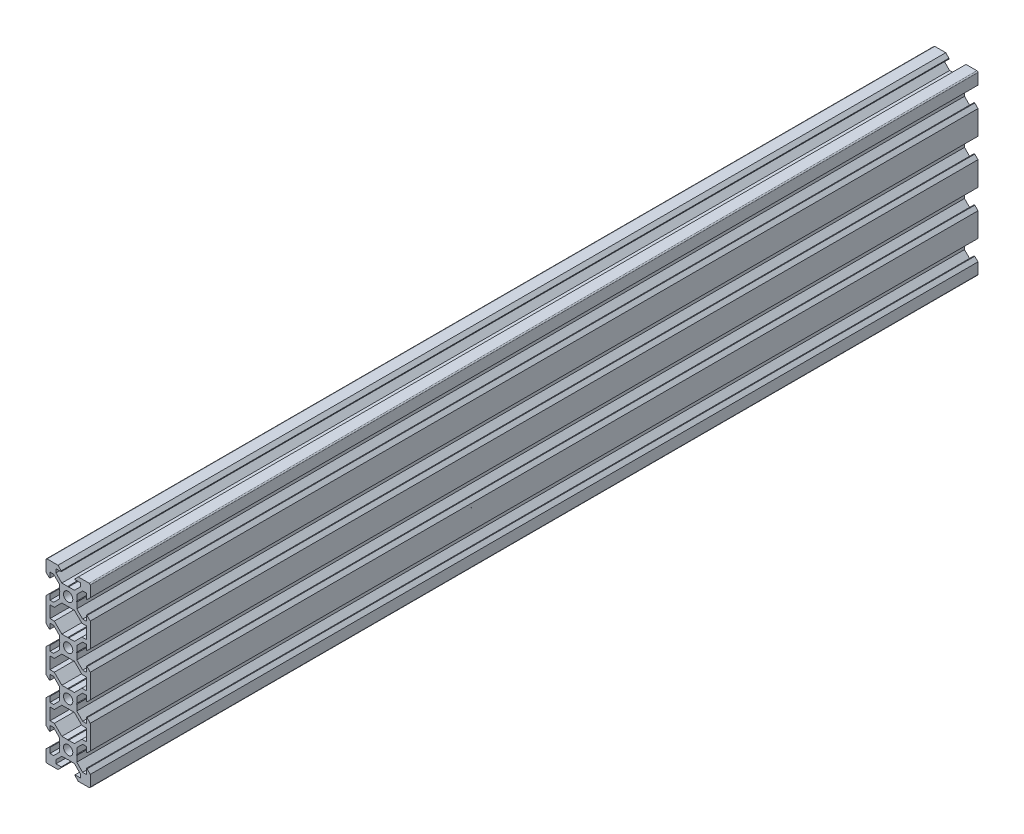
from build123d import *

# Parameters (mm, degrees)
BOSS_EXTRU_1_DEPTH = 401.2


with BuildPart() as part:
    # Esquisse1 → Boss.-Extru.1 (new body)
    with BuildSketch(Plane.XY):
        with BuildLine():
            Line((-9.5, 10), (-4.58, 10))
            Line((-4.58, 10), (-3.125, 8.545))
            Line((-3.125, 8.545), (-3.125, 8.2))
            Line((-3.125, 8.2), (-5.5, 8.2))
            Line((-5.5, 8.2), (-5.5, 6.560660172))
            Line((-5.5, 6.560660172), (-2.839339828, 3.9))
            Line((-2.839339828, 3.9), (-0.21, 3.9))
            Line((-0.21, 3.9), (0, 3.69))
            Line((0, 3.69), (0, 2.1))
            ThreePointArc((0, 2.1), (-2.1, 0), (0, -2.1))
            Line((0, -2.1), (0, -3.69))
            Line((0, -3.69), (-0.21, -3.9))
            Line((-0.21, -3.9), (-2.839339828, -3.9))
            Line((-2.839339828, -3.9), (-6.239339828, -7.3))
            Line((-6.239339828, -7.3), (-8.2, -7.3))
            Line((-8.2, -7.3), (-8.2, -12.7))
            Line((-8.2, -12.7), (-6.239339828, -12.7))
            Line((-6.239339828, -12.7), (-2.839339828, -16.1))
            Line((-2.839339828, -16.1), (-0.21, -16.1))
            Line((-0.21, -16.1), (0, -16.31))
            Line((0, -16.31), (0, -17.9))
            ThreePointArc((0, -17.9), (-2.1, -20), (0, -22.1))
            Line((0, -22.1), (0, -23.69))
            Line((0, -23.69), (-0.21, -23.9))
            Line((-0.21, -23.9), (-2.839339828, -23.9))
            Line((-2.839339828, -23.9), (-6.239339828, -27.3))
            Line((-6.239339828, -27.3), (-8.2, -27.3))
            Line((-8.2, -27.3), (-8.2, -32.7))
            Line((-8.2, -32.7), (-6.239339828, -32.7))
            Line((-6.239339828, -32.7), (-2.839339828, -36.1))
            Line((-2.839339828, -36.1), (-0.21, -36.1))
            Line((-0.21, -36.1), (0, -36.31))
            Line((0, -36.31), (0, -37.9))
            ThreePointArc((0, -37.9), (-2.1, -40), (0, -42.1))
            Line((0, -42.1), (0, -43.69))
            Line((0, -43.69), (-0.21, -43.9))
            Line((-0.21, -43.9), (-2.839339828, -43.9))
            Line((-2.839339828, -43.9), (-6.239339828, -47.3))
            Line((-6.239339828, -47.3), (-8.2, -47.3))
            Line((-8.2, -47.3), (-8.2, -52.7))
            Line((-8.2, -52.7), (-6.239339828, -52.7))
            Line((-6.239339828, -52.7), (-2.839339828, -56.1))
            Line((-2.839339828, -56.1), (-0.21, -56.1))
            Line((-0.21, -56.1), (0, -56.31))
            Line((0, -56.31), (0, -57.9))
            ThreePointArc((0, -57.9), (-2.1, -60), (0, -62.1))
            Line((0, -62.1), (0, -63.69))
            Line((0, -63.69), (-0.21, -63.9))
            Line((-0.21, -63.9), (-2.839339828, -63.9))
            Line((-2.839339828, -63.9), (-5.5, -66.560660172))
            Line((-5.5, -66.560660172), (-5.5, -68.2))
            Line((-5.5, -68.2), (-3.125, -68.2))
            Line((-3.125, -68.2), (-3.125, -68.545))
            Line((-3.125, -68.545), (-4.58, -70))
            Line((-4.58, -70), (-9.5, -70))
            ThreePointArc((-9.5, -70), (-9.853553391, -69.853553391), (-10, -69.5))
            Line((-10, -69.5), (-10, -64.58))
            Line((-10, -64.58), (-8.545, -63.125))
            Line((-8.545, -63.125), (-8.2, -63.125))
            Line((-8.2, -63.125), (-8.2, -65.5))
            Line((-8.2, -65.5), (-6.560660172, -65.5))
            Line((-6.560660172, -65.5), (-3.9, -62.839339828))
            Line((-3.9, -62.839339828), (-3.9, -60.21))
            Line((-3.9, -60.21), (-3.69, -60))
            Line((-3.69, -60), (-3.9, -59.79))
            Line((-3.9, -59.79), (-3.9, -57.160660172))
            Line((-3.9, -57.160660172), (-6.560660172, -54.5))
            Line((-6.560660172, -54.5), (-8.2, -54.5))
            Line((-8.2, -54.5), (-8.2, -56.875))
            Line((-8.2, -56.875), (-8.545, -56.875))
            Line((-8.545, -56.875), (-10, -55.42))
            Line((-10, -55.42), (-10, -44.58))
            Line((-10, -44.58), (-8.545, -43.125))
            Line((-8.545, -43.125), (-8.2, -43.125))
            Line((-8.2, -43.125), (-8.2, -45.5))
            Line((-8.2, -45.5), (-6.560660172, -45.5))
            Line((-6.560660172, -45.5), (-3.9, -42.839339828))
            Line((-3.9, -42.839339828), (-3.9, -40.21))
            Line((-3.9, -40.21), (-3.69, -40))
            Line((-3.69, -40), (-3.9, -39.79))
            Line((-3.9, -39.79), (-3.9, -37.160660172))
            Line((-3.9, -37.160660172), (-6.560660172, -34.5))
            Line((-6.560660172, -34.5), (-8.2, -34.5))
            Line((-8.2, -34.5), (-8.2, -36.875))
            Line((-8.2, -36.875), (-8.545, -36.875))
            Line((-8.545, -36.875), (-10, -35.42))
            Line((-10, -35.42), (-10, -24.58))
            Line((-10, -24.58), (-8.545, -23.125))
            Line((-8.545, -23.125), (-8.2, -23.125))
            Line((-8.2, -23.125), (-8.2, -25.5))
            Line((-8.2, -25.5), (-6.560660172, -25.5))
            Line((-6.560660172, -25.5), (-3.9, -22.839339828))
            Line((-3.9, -22.839339828), (-3.9, -20.21))
            Line((-3.9, -20.21), (-3.69, -20))
            Line((-3.69, -20), (-3.9, -19.79))
            Line((-3.9, -19.79), (-3.9, -17.160660172))
            Line((-3.9, -17.160660172), (-6.560660172, -14.5))
            Line((-6.560660172, -14.5), (-8.2, -14.5))
            Line((-8.2, -14.5), (-8.2, -16.875))
            Line((-8.2, -16.875), (-8.545, -16.875))
            Line((-8.545, -16.875), (-10, -15.42))
            Line((-10, -15.42), (-10, -4.58))
            Line((-10, -4.58), (-8.545, -3.125))
            Line((-8.545, -3.125), (-8.2, -3.125))
            Line((-8.2, -3.125), (-8.2, -5.5))
            Line((-8.2, -5.5), (-6.560660172, -5.5))
            Line((-6.560660172, -5.5), (-3.9, -2.839339828))
            Line((-3.9, -2.839339828), (-3.9, -0.21))
            Line((-3.9, -0.21), (-3.69, 0))
            Line((-3.69, 0), (-3.9, 0.21))
            Line((-3.9, 0.21), (-3.9, 2.839339828))
            Line((-3.9, 2.839339828), (-6.560660172, 5.5))
            Line((-6.560660172, 5.5), (-8.2, 5.5))
            Line((-8.2, 5.5), (-8.2, 3.125))
            Line((-8.2, 3.125), (-8.545, 3.125))
            Line((-8.545, 3.125), (-10, 4.58))
            Line((-10, 4.58), (-10, 9.5))
            ThreePointArc((-10, 9.5), (-9.853553391, 9.853553391), (-9.5, 10))
        make_face()
    boss_extru_1 = extrude(amount=BOSS_EXTRU_1_DEPTH)

    # Symétrie1: Boss.-Extru.1 across plane
    add(boss_extru_1.mirror(Plane(origin=(0, 3.69, 401.2), x_dir=(0, 0, 1), z_dir=(-1, 0, 0))))


solid = part.part
